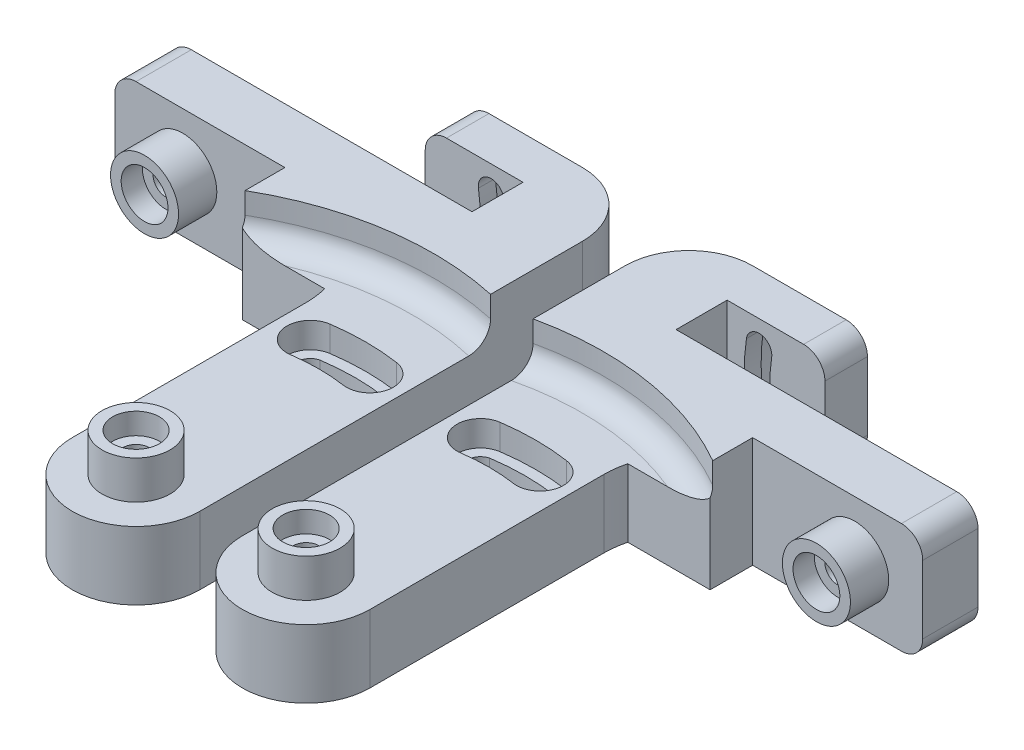
from build123d import *
from build123d.topology import SkipClean

# Parameters (mm, degrees)
SKETCH1_R           = 1.5
BOSS_EXTRUDE1_DEPTH = 8
SKETCH2_R           = 4
SKETCH2_R_2         = 1.5
BOSS_EXTRUDE2_DEPTH = 2
SKETCH4_R           = 4
SKETCH4_R_2         = 2.75
BOSS_EXTRUDE3_DEPTH = 2.5
CUT_EXTRUDE1_DEPTH  = 3
BOSS_EXTRUDE4_DEPTH = 5
SKETCH12_W          = 20
SKETCH12_H          = 13
BOSS_EXTRUDE5_DEPTH = 2.5
BOSS_EXTRUDE6_DEPTH = 13
BOSS_EXTRUDE7_DEPTH = 8
SKETCH6_R           = 1.5
CUT_EXTRUDE5_DEPTH  = 17
SKETCH6_8_R         = 1.5
CUT_EXTRUDE6_DEPTH  = 3
SKETCH17_R          = 4
SKETCH17_R_2        = 1.5
BOSS_EXTRUDE8_DEPTH = 2
SKETCH18_R          = 4
SKETCH18_R_2        = 2.75
BOSS_EXTRUDE9_DEPTH = 2.5
FILLET3_R           = 2.5
CUT_EXTRUDE7_START  = -10
SKETCH21_R          = 1.5
CUT_EXTRUDE7_DEPTH  = 10


with BuildPart() as part:
    # Sketch1 → Boss-Extrude1 (new body)
    with BuildSketch(Plane(origin=(0, 0, 0), x_dir=(1, 0, 0), z_dir=(0, 1, 0))):
        with BuildLine():
            Line((-7.5, 41.5), (-37.5, 41.5))
            Line((-37.5, 41.5), (-37.5, 37.5))
            Line((-37.5, 37.5), (-17.5, 37.5))
            ThreePointArc((-17.5, 37.5), (-10.428932188, 34.571067812), (-7.5, 27.5))
            Line((-7.5, 27.5), (-7.5, 0))
            ThreePointArc((-7.5, 0), (0, -7.5), (7.5, 0))
            Line((7.5, 0), (7.5, 45))
            ThreePointArc((7.5, 45), (5.303300859, 50.303300859), (0, 52.5))
            Line((0, 52.5), (-13.5, 52.5))
            Line((-13.5, 52.5), (-13.5, 47.5))
            Line((-13.5, 47.5), (-2, 47.5))
            Line((-2, 47.5), (-2, 41.5))
            Line((-2, 41.5), (-7.5, 41.5))
        make_face()
        with Locations(Location((0, 0, 0), (0, 0, 270))):
            Circle(SKETCH1_R, mode=Mode.SUBTRACT)
        with BuildLine():
            ThreePointArc((-3.822328563, 25.461052236), (-4.975312132, 23.725069238), (-3.280610142, 22.512224135))
            ThreePointArc((-3.280610142, 22.512224135), (-0.049039296, 22.749950188), (3.183526389, 22.526158087))
            ThreePointArc((3.183526389, 22.526158087), (4.964339908, 23.654663936), (3.8662866, 25.454414245))
            ThreePointArc((3.8662866, 25.454414245), (0.022228203, 25.746356684), (-3.822328563, 25.461052236))
        make_face(mode=Mode.SUBTRACT)
    extrude(amount=BOSS_EXTRUDE1_DEPTH)

    # Sketch2 → Boss-Extrude2 (add)
    with BuildSketch(Plane(origin=(0, 8, 0), x_dir=(1, 0, 0), z_dir=(0, 1, 0))):
        with Locations(Location((0, 0, 0), (0, 0, 270))):
            Circle(SKETCH2_R)
        with Locations(Location((0, 0, 0), (0, 0, 270))):
            Circle(SKETCH2_R_2, mode=Mode.SUBTRACT)
    extrude(amount=BOSS_EXTRUDE2_DEPTH)

    # Sketch4 → Boss-Extrude3 (add)
    with BuildSketch(Plane(origin=(0, 10, 0), x_dir=(1, 0, 0), z_dir=(0, 1, 0))):
        with Locations(Location((0, 0, 0), (0, 0, 270))):
            Circle(SKETCH4_R)
        with Locations(Location((0, 0, 0), (0, 0, 270))):
            Circle(SKETCH4_R_2, mode=Mode.SUBTRACT)
    extrude(amount=BOSS_EXTRUDE3_DEPTH)

    # Sketch5 → Cut-Extrude1 (cut)
    with BuildSketch(Plane(origin=(0, 8, 0), x_dir=(1, 0, 0), z_dir=(0, 1, 0))):
        with BuildLine():
            ThreePointArc((-3.896907216, 26.717299904), (-6.221206472, 23.599186216), (-3.103092784, 21.27488696))
            ThreePointArc((-3.103092784, 21.27488696), (0, 21.5), (3.103092784, 21.27488696))
            ThreePointArc((3.103092784, 21.27488696), (6.221206472, 23.599186216), (3.896907216, 26.717299904))
            ThreePointArc((3.896907216, 26.717299904), (0, 27), (-3.896907216, 26.717299904))
        make_face()
    extrude(amount=-CUT_EXTRUDE1_DEPTH, mode=Mode.SUBTRACT)

    # Sketch11 → Boss-Extrude4 (add)
    with BuildSketch(Plane(origin=(0, 8, 0), x_dir=(1, 0, 0), z_dir=(0, 1, 0))):
        with BuildLine():
            Line((-13.5, 47.5), (-2, 47.5))
            Line((-2, 47.5), (-2, 41.5))
            Line((-2, 41.5), (-37.5, 41.5))
            Line((-37.5, 41.5), (-37.5, 37.5))
            Line((-37.5, 37.5), (-17.5, 37.5))
            ThreePointArc((-17.5, 37.5), (-13.114141424, 36.486892931), (-9.616951713, 33.65284891))
            ThreePointArc((-9.616951713, 33.65284891), (-1.091648616, 34.982971619), (7.5, 34.186985828))
            Line((7.5, 34.186985828), (7.5, 45))
            ThreePointArc((7.5, 45), (5.303300859, 50.303300859), (0, 52.5))
            Line((0, 52.5), (-13.5, 52.5))
            Line((-13.5, 52.5), (-13.5, 47.5))
        make_face()
    extrude(amount=BOSS_EXTRUDE4_DEPTH)

    # Sketch12 → Boss-Extrude5 (add)
    with BuildSketch(Plane.XY.offset(-37.5)):
        with Locations((-27.5, 6.5)):
            Rectangle(SKETCH12_W, SKETCH12_H)
    extrude(amount=BOSS_EXTRUDE5_DEPTH)

    # Sketch14 → Boss-Extrude6 (add)
    with BuildSketch(Plane(origin=(0, 0, 0), x_dir=(1, 0, 0), z_dir=(0, 1, 0))):
        with BuildLine():
            Line((-17.5, 30.310889132), (-17.5, 37.5))
            ThreePointArc((-17.5, 37.5), (-13.114141424, 36.486892931), (-9.616951713, 33.65284891))
            ThreePointArc((-9.616951713, 33.65284891), (-13.661055645, 32.223835257), (-17.5, 30.310889132))
        make_face()
    extrude(amount=BOSS_EXTRUDE6_DEPTH)

    # Sketch15 → Boss-Extrude7 (add)
    with BuildSketch(Plane(origin=(0, 0, 0), x_dir=(1, 0, 0), z_dir=(0, 1, 0))):
        with BuildLine():
            Line((-17.5, 30), (-17.5, 30.310889132))
            ThreePointArc((-17.5, 30.310889132), (-13.661055645, 32.223835257), (-9.616951713, 33.65284891))
            ThreePointArc((-9.616951713, 33.65284891), (-8.529348838, 31.918983788), (-7.817541634, 30))
            Line((-7.817541634, 30), (-17.5, 30))
        make_face()
    extrude(amount=BOSS_EXTRUDE7_DEPTH)

    # Sketch6 → Cut-Extrude5 (cut)
    with BuildSketch(Plane(origin=(0, 0, -52.5), x_dir=(-1, 0, 0), z_dir=(0, 0, -1))):
        with BuildLine():
            ThreePointArc((7.240543618, 9.78125), (5.975329859, 11.483963759), (4.2726161, 10.21875))
            ThreePointArc((4.2726161, 10.21875), (4, 6.5), (4.2726161, 2.78125))
            ThreePointArc((4.2726161, 2.78125), (5.975329859, 1.516036241), (7.240543618, 3.21875))
            ThreePointArc((7.240543618, 3.21875), (7, 6.5), (7.240543618, 9.78125))
        make_face()
        with Locations((29.5, 6.5)):
            Circle(SKETCH6_R)
    extrude(amount=-CUT_EXTRUDE5_DEPTH, mode=Mode.SUBTRACT)

    # Sketch6<8> → Cut-Extrude6 (cut)
    # profile 1 of 2: a face of its own
    with BuildSketch(Plane(origin=(0, 0, -52.5), x_dir=(-1, 0, 0), z_dir=(0, 0, -1))):
        with Locations((29.5, 6.5)):
            Circle(SKETCH6_8_R)
    # profile 2 of 2: a face of its own
    with BuildSketch(Plane(origin=(0, 0, -52.5), x_dir=(-1, 0, 0), z_dir=(0, 0, -1))):
        with BuildLine():
            ThreePointArc((8.477180083, 9.598958333), (6.157621525, 12.720600225), (3.035979634, 10.401041667))
            ThreePointArc((3.035979634, 10.401041667), (2.75, 6.5), (3.035979634, 2.598958333))
            ThreePointArc((3.035979634, 2.598958333), (6.157621525, 0.279399775), (8.477180083, 3.401041667))
            ThreePointArc((8.477180083, 3.401041667), (8.25, 6.5), (8.477180083, 9.598958333))
        make_face()
        with BuildLine():
            ThreePointArc((7.240543618, 9.78125), (5.975329859, 11.483963759), (4.2726161, 10.21875))
            ThreePointArc((4.2726161, 10.21875), (4, 6.5), (4.2726161, 2.78125))
            ThreePointArc((4.2726161, 2.78125), (5.975329859, 1.516036241), (7.240543618, 3.21875))
            ThreePointArc((7.240543618, 3.21875), (7, 6.5), (7.240543618, 9.78125))
        make_face(mode=Mode.SUBTRACT)
    extrude(amount=-CUT_EXTRUDE6_DEPTH, mode=Mode.SUBTRACT)

    # Sketch17 → Boss-Extrude8 (add)
    with BuildSketch(Plane.XY.offset(-35)):
        with Locations((-29.5, 6.5)):
            Circle(SKETCH17_R)
        with Locations(Location((-29.5, 6.5, 0), (0, 0, 180))):
            Circle(SKETCH17_R_2, mode=Mode.SUBTRACT)
    extrude(amount=BOSS_EXTRUDE8_DEPTH)

    # Sketch18 → Boss-Extrude9 (add)
    with BuildSketch(Plane.XY.offset(-33)):
        with Locations((-29.5, 6.5)):
            Circle(SKETCH18_R)
        with Locations((-29.5, 6.5)):
            Circle(SKETCH18_R_2, mode=Mode.SUBTRACT)
    extrude(amount=BOSS_EXTRUDE9_DEPTH)

    # Fillet3
    fillet3_edges = [part.edges().sort_by_distance(p)[0] for p in [
        (-13.5, 0, -50),
        (-13.5, 13, -50),
        (-37.5, 0, -38.25),
        (-37.5, 13, -38.25),
        (-5.362465049, 8, -34.586760019),
    ]]
    fillet(fillet3_edges, radius=FILLET3_R)

    # Sketch21 → Cut-Extrude7 (cut)
    with SkipClean():  # the faces are left unmerged after this step: merging them gives an invalid solid
        with BuildSketch(Plane.XY.offset(-35).offset(CUT_EXTRUDE7_START)):
            with Locations((-29.5, 6.5)):
                Circle(SKETCH21_R)
        extrude(amount=CUT_EXTRUDE7_DEPTH, mode=Mode.SUBTRACT)


with BuildPart() as body_2:
    # Mirror4: mirrored copy
    add(part.part.mirror(Plane(origin=(10, 0, 0), x_dir=(0, 0, 1), z_dir=(1, 0, 0))))


solid = Compound([part.part, body_2.part])
